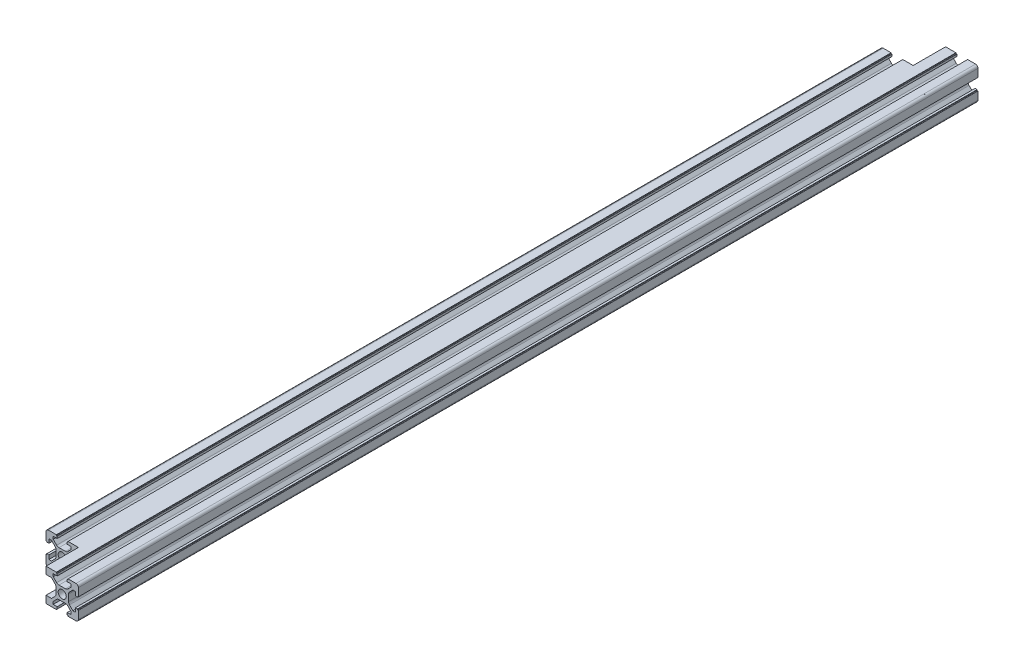
from build123d import *

# Parameters (mm, degrees)
SKETCH1_R               = 2.5
EXTRUDE1_DEPTH          = 277.5
CUT_EXTRUDE1_DEPTH      = 556.900170894
CUT_EXTRUDE1_DEPTH_BACK = 556.900170894
SKETCH2_W               = 3.3
SKETCH2_H               = 11.078679656
SKETCH3_W               = 21.963498752
SKETCH3_H               = 21.444138823
CUT_EXTRUDE2_DEPTH      = 20


with BuildPart() as part:
    # Sketch1 → Extrude1 (new, symmetric)
    with BuildSketch(Plane.XY):
        with BuildLine():
            Line((0, 3.9), (-2.010912703, 3.9))
            ThreePointArc((-2.010912703, 3.9), (-2.776279568, 4.052240935), (-3.425126266, 4.485786438))
            Line((-3.425126266, 4.485786438), (-5.539339828, 6.6))
            Line((-5.539339828, 6.6), (-5.539339828, 8.2))
            Line((-5.539339828, 8.2), (-3.1, 8.2))
            Line((-3.1, 8.2), (-3.1, 9.5))
            Line((-3.1, 9.5), (-3.4, 9.5))
            ThreePointArc((-3.4, 9.5), (-3.541421356, 9.558578644), (-3.6, 9.7))
            Line((-3.6, 9.7), (-3.6, 10))
            Line((-3.6, 10), (-8.5, 10))
            Line((-8.5, 10), (-11.5, 10))
            Line((-11.5, 10), (-16.4, 10))
            Line((-16.4, 10), (-16.4, 9.7))
            ThreePointArc((-16.4, 9.7), (-16.458578644, 9.558578644), (-16.6, 9.5))
            Line((-16.6, 9.5), (-16.9, 9.5))
            Line((-16.9, 9.5), (-16.9, 8.2))
            Line((-16.9, 8.2), (-14.460660172, 8.2))
            Line((-14.460660172, 8.2), (-14.460660172, 6.6))
            Line((-14.460660172, 6.6), (-16.574873734, 4.485786438))
            ThreePointArc((-16.574873734, 4.485786438), (-17.223720432, 4.052240935), (-17.989087297, 3.9))
            Line((-17.989087297, 3.9), (-20, 3.9))
            Line((-20, 3.9), (-22.010912703, 3.9))
            ThreePointArc((-22.010912703, 3.9), (-22.776279568, 4.052240935), (-23.425126266, 4.485786438))
            Line((-23.425126266, 4.485786438), (-25.539339828, 6.6))
            Line((-25.539339828, 6.6), (-25.539339828, 8.2))
            Line((-25.539339828, 8.2), (-23.1, 8.2))
            Line((-23.1, 8.2), (-23.1, 9.5))
            Line((-23.1, 9.5), (-23.4, 9.5))
            ThreePointArc((-23.4, 9.5), (-23.541421356, 9.558578644), (-23.6, 9.7))
            Line((-23.6, 9.7), (-23.6, 10))
            Line((-23.6, 10), (-28.5, 10))
            ThreePointArc((-28.5, 10), (-29.560660172, 9.560660172), (-30, 8.5))
            Line((-30, 8.5), (-30, 3.6))
            Line((-30, 3.6), (-29.7, 3.6))
            ThreePointArc((-29.7, 3.6), (-29.558578644, 3.541421356), (-29.5, 3.4))
            Line((-29.5, 3.4), (-29.5, 3.1))
            Line((-29.5, 3.1), (-28.2, 3.1))
            Line((-28.2, 3.1), (-28.2, 5.539339828))
            Line((-28.2, 5.539339828), (-26.6, 5.539339828))
            Line((-26.6, 5.539339828), (-24.485786438, 3.425126266))
            ThreePointArc((-24.485786438, 3.425126266), (-24.052240935, 2.776279568), (-23.9, 2.010912703))
            Line((-23.9, 2.010912703), (-23.9, 0))
            Line((-23.9, 0), (-23.9, -2.010912703))
            ThreePointArc((-23.9, -2.010912703), (-24.052240935, -2.776279568), (-24.485786438, -3.425126266))
            Line((-24.485786438, -3.425126266), (-26.6, -5.539339828))
            Line((-26.6, -5.539339828), (-28.2, -5.539339828))
            Line((-28.2, -5.539339828), (-28.2, -3.1))
            Line((-28.2, -3.1), (-29.5, -3.1))
            Line((-29.5, -3.1), (-29.5, -3.4))
            ThreePointArc((-29.5, -3.4), (-29.558578644, -3.541421356), (-29.7, -3.6))
            Line((-29.7, -3.6), (-30, -3.6))
            Line((-30, -3.6), (-30, -8.5))
            ThreePointArc((-30, -8.5), (-29.560660172, -9.560660172), (-28.5, -10))
            Line((-28.5, -10), (-23.6, -10))
            Line((-23.6, -10), (-23.6, -9.7))
            ThreePointArc((-23.6, -9.7), (-23.541421356, -9.558578644), (-23.4, -9.5))
            Line((-23.4, -9.5), (-23.1, -9.5))
            Line((-23.1, -9.5), (-23.1, -8.2))
            Line((-23.1, -8.2), (-25.539339828, -8.2))
            Line((-25.539339828, -8.2), (-25.539339828, -6.6))
            Line((-25.539339828, -6.6), (-23.425126266, -4.485786438))
            ThreePointArc((-23.425126266, -4.485786438), (-22.776279568, -4.052240935), (-22.010912703, -3.9))
            Line((-22.010912703, -3.9), (-20, -3.9))
            Line((-20, -3.9), (-17.989087297, -3.9))
            ThreePointArc((-17.989087297, -3.9), (-17.223720432, -4.052240935), (-16.574873734, -4.485786438))
            Line((-16.574873734, -4.485786438), (-14.460660172, -6.6))
            Line((-14.460660172, -6.6), (-14.460660172, -8.2))
            Line((-14.460660172, -8.2), (-16.9, -8.2))
            Line((-16.9, -8.2), (-16.9, -9.5))
            Line((-16.9, -9.5), (-16.6, -9.5))
            ThreePointArc((-16.6, -9.5), (-16.458578644, -9.558578644), (-16.4, -9.7))
            Line((-16.4, -9.7), (-16.4, -10))
            Line((-16.4, -10), (-11.5, -10))
            Line((-11.5, -10), (-8.5, -10))
            Line((-8.5, -10), (-3.6, -10))
            Line((-3.6, -10), (-3.6, -9.7))
            ThreePointArc((-3.6, -9.7), (-3.541421356, -9.558578644), (-3.4, -9.5))
            Line((-3.4, -9.5), (-3.1, -9.5))
            Line((-3.1, -9.5), (-3.1, -8.2))
            Line((-3.1, -8.2), (-5.539339828, -8.2))
            Line((-5.539339828, -8.2), (-5.539339828, -6.6))
            Line((-5.539339828, -6.6), (-3.425126266, -4.485786438))
            ThreePointArc((-3.425126266, -4.485786438), (-2.776279568, -4.052240935), (-2.010912703, -3.9))
            Line((-2.010912703, -3.9), (0, -3.9))
            Line((0, -3.9), (2.010912703, -3.9))
            ThreePointArc((2.010912703, -3.9), (2.776279568, -4.052240935), (3.425126266, -4.485786438))
            Line((3.425126266, -4.485786438), (5.539339828, -6.6))
            Line((5.539339828, -6.6), (5.539339828, -8.2))
            Line((5.539339828, -8.2), (3.1, -8.2))
            Line((3.1, -8.2), (3.1, -9.5))
            Line((3.1, -9.5), (3.4, -9.5))
            ThreePointArc((3.4, -9.5), (3.541421356, -9.558578644), (3.6, -9.7))
            Line((3.6, -9.7), (3.6, -10))
            Line((3.6, -10), (8.5, -10))
            ThreePointArc((8.5, -10), (9.560660172, -9.560660172), (10, -8.5))
            Line((10, -8.5), (10, -3.6))
            Line((10, -3.6), (9.7, -3.6))
            ThreePointArc((9.7, -3.6), (9.558578644, -3.541421356), (9.5, -3.4))
            Line((9.5, -3.4), (9.5, -3.1))
            Line((9.5, -3.1), (8.2, -3.1))
            Line((8.2, -3.1), (8.2, -5.539339828))
            Line((8.2, -5.539339828), (6.6, -5.539339828))
            Line((6.6, -5.539339828), (4.485786438, -3.425126266))
            ThreePointArc((4.485786438, -3.425126266), (4.052240935, -2.776279568), (3.9, -2.010912703))
            Line((3.9, -2.010912703), (3.9, 0))
            Line((3.9, 0), (3.9, 2.010912703))
            ThreePointArc((3.9, 2.010912703), (4.052240935, 2.776279568), (4.485786438, 3.425126266))
            Line((4.485786438, 3.425126266), (6.6, 5.539339828))
            Line((6.6, 5.539339828), (8.2, 5.539339828))
            Line((8.2, 5.539339828), (8.2, 3.1))
            Line((8.2, 3.1), (9.5, 3.1))
            Line((9.5, 3.1), (9.5, 3.4))
            ThreePointArc((9.5, 3.4), (9.558578644, 3.541421356), (9.7, 3.6))
            Line((9.7, 3.6), (10, 3.6))
            Line((10, 3.6), (10, 8.5))
            ThreePointArc((10, 8.5), (9.560660172, 9.560660172), (8.5, 10))
            Line((8.5, 10), (3.6, 10))
            Line((3.6, 10), (3.6, 9.7))
            ThreePointArc((3.6, 9.7), (3.541421356, 9.558578644), (3.4, 9.5))
            Line((3.4, 9.5), (3.1, 9.5))
            Line((3.1, 9.5), (3.1, 8.2))
            Line((3.1, 8.2), (5.539339828, 8.2))
            Line((5.539339828, 8.2), (5.539339828, 6.6))
            Line((5.539339828, 6.6), (3.425126266, 4.485786438))
            ThreePointArc((3.425126266, 4.485786438), (2.776279568, 4.052240935), (2.010912703, 3.9))
            Line((2.010912703, 3.9), (0, 3.9))
        make_face()
        Circle(SKETCH1_R, mode=Mode.SUBTRACT)
        with Locations(Location((-20, 0, 0), (0, 0, 180))):
            Circle(SKETCH1_R, mode=Mode.SUBTRACT)
        with BuildLine():
            Line((-9.7, 3.6), (-10, 3.6))
            ThreePointArc((-10, 3.6), (-10.141421356, 3.541421356), (-10.2, 3.4))
            Line((-10.2, 3.4), (-10.2, 3.1))
            Line((-10.2, 3.1), (-11.5, 3.1))
            Line((-11.5, 3.1), (-11.5, 5.539339828))
            Line((-11.5, 5.539339828), (-13.1, 5.539339828))
            Line((-13.1, 5.539339828), (-15.214213562, 3.425126266))
            ThreePointArc((-15.214213562, 3.425126266), (-15.647759065, 2.776279568), (-15.8, 2.010912703))
            Line((-15.8, 2.010912703), (-15.8, 0))
            Line((-15.8, 0), (-15.8, -2.010912703))
            ThreePointArc((-15.8, -2.010912703), (-15.647759065, -2.776279568), (-15.214213562, -3.425126266))
            Line((-15.214213562, -3.425126266), (-13.1, -5.539339828))
            Line((-13.1, -5.539339828), (-11.5, -5.539339828))
            Line((-11.5, -5.539339828), (-11.5, -3.1))
            Line((-11.5, -3.1), (-10.2, -3.1))
            Line((-10.2, -3.1), (-10.2, -3.4))
            ThreePointArc((-10.2, -3.4), (-10.141421356, -3.541421356), (-10, -3.6))
            Line((-10, -3.6), (-9.7, -3.6))
            ThreePointArc((-9.7, -3.6), (-9.558578644, -3.541421356), (-9.5, -3.4))
            Line((-9.5, -3.4), (-9.5, -3.1))
            Line((-9.5, -3.1), (-8.2, -3.1))
            Line((-8.2, -3.1), (-8.2, -5.539339828))
            Line((-8.2, -5.539339828), (-6.6, -5.539339828))
            Line((-6.6, -5.539339828), (-4.485786438, -3.425126266))
            ThreePointArc((-4.485786438, -3.425126266), (-4.052240935, -2.776279568), (-3.9, -2.010912703))
            Line((-3.9, -2.010912703), (-3.9, 0))
            Line((-3.9, 0), (-3.9, 2.010912703))
            ThreePointArc((-3.9, 2.010912703), (-4.052240935, 2.776279568), (-4.485786438, 3.425126266))
            Line((-4.485786438, 3.425126266), (-6.6, 5.539339828))
            Line((-6.6, 5.539339828), (-8.2, 5.539339828))
            Line((-8.2, 5.539339828), (-8.2, 3.1))
            Line((-8.2, 3.1), (-9.5, 3.1))
            Line((-9.5, 3.1), (-9.5, 3.4))
            ThreePointArc((-9.5, 3.4), (-9.558578644, 3.541421356), (-9.7, 3.6))
        make_face(mode=Mode.SUBTRACT)
    extrude(amount=EXTRUDE1_DEPTH, both=True)

    # Sketch2 → Cut-Extrude1 (cut, two sides: drawn at the far end of the back side and taken through both)
    with BuildSketch(Plane.XY.offset(277.5).offset(-CUT_EXTRUDE1_DEPTH_BACK)):
        with Locations((-9.85, 0)):
            Rectangle(SKETCH2_W, SKETCH2_H)
    extrude(amount=CUT_EXTRUDE1_DEPTH + CUT_EXTRUDE1_DEPTH_BACK, mode=Mode.SUBTRACT)

    # Sketch3 → Cut-Extrude2 (cut)
    with BuildSketch(Plane.XY.offset(277.5)):
        with Locations((-20.981749376, 0.722069412)):
            Rectangle(SKETCH3_W, SKETCH3_H)
    cut_extrude2 = extrude(amount=-CUT_EXTRUDE2_DEPTH, mode=Mode.SUBTRACT)

    # Mirror1: Cut-Extrude2 across plane
    add(cut_extrude2.mirror(Plane.XY), mode=Mode.SUBTRACT)


solid = part.part
